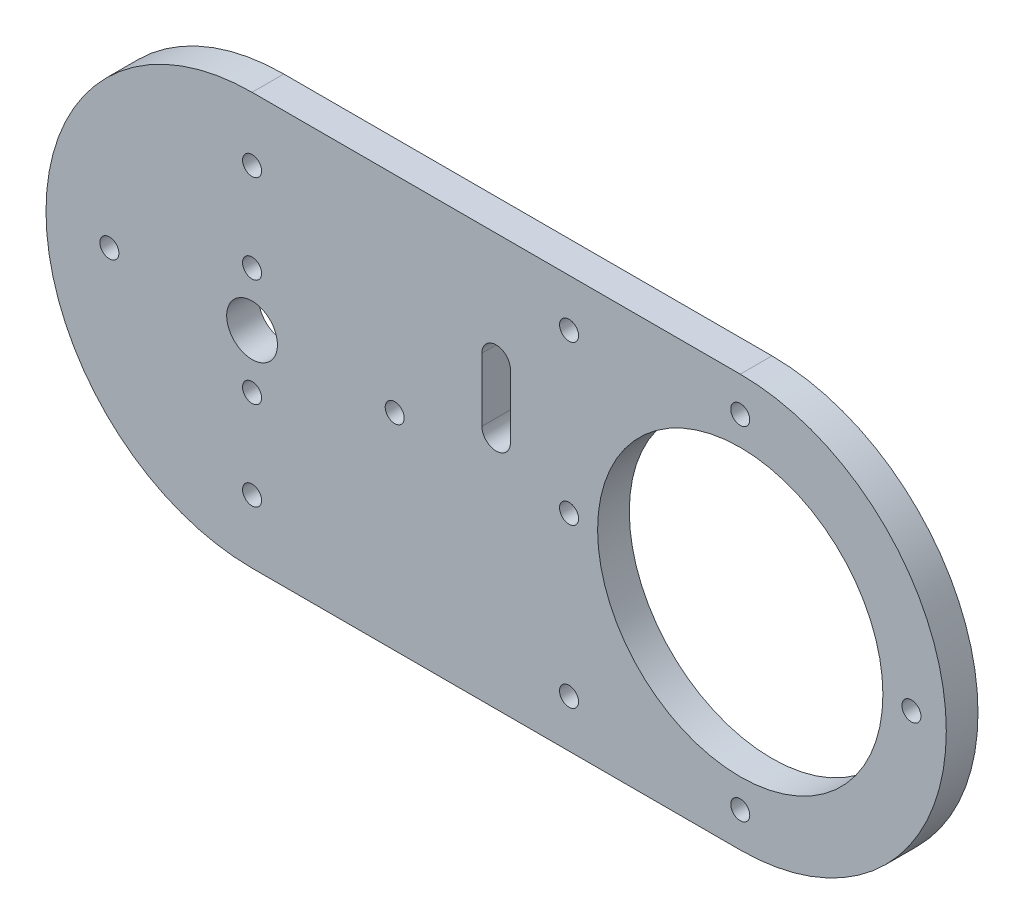
from build123d import *

# Parameters (mm, degrees)
SKETCH1_R           = 4
SKETCH1_R_2         = 22.5
SKETCH1_R_3         = 1.5
BOSS_EXTRUDE1_DEPTH = 5


with BuildPart() as part:
    # Sketch1 → Boss-Extrude1 (new body)
    with BuildSketch(Plane.XY):
        with BuildLine():
            Line((-38.5, 32.5), (38.5, 32.5))
            ThreePointArc((38.5, 32.5), (71, 0), (38.5, -32.5))
            Line((38.5, -32.5), (-38.5, -32.5))
            ThreePointArc((-38.5, -32.5), (-71, 0), (-38.5, 32.5))
        make_face()
        with Locations((-38.5, 0)):
            Circle(SKETCH1_R, mode=Mode.SUBTRACT)
        with Locations((38.5, 0)):
            Circle(SKETCH1_R_2, mode=Mode.SUBTRACT)
        with Locations((-38.5, 22.5)):
            Circle(SKETCH1_R_3, mode=Mode.SUBTRACT)
        with Locations((-16, 0)):
            Circle(SKETCH1_R_3, mode=Mode.SUBTRACT)
        with Locations((-38.5, -22.5)):
            Circle(SKETCH1_R_3, mode=Mode.SUBTRACT)
        with Locations((-61, 0)):
            Circle(SKETCH1_R_3, mode=Mode.SUBTRACT)
        with Locations((11.5, 0)):
            Circle(SKETCH1_R_3, mode=Mode.SUBTRACT)
        with Locations((11.5, -25)):
            Circle(SKETCH1_R_3, mode=Mode.SUBTRACT)
        with Locations((11.5, 25)):
            Circle(SKETCH1_R_3, mode=Mode.SUBTRACT)
        with Locations((65.5, 0)):
            Circle(SKETCH1_R_3, mode=Mode.SUBTRACT)
        with Locations((-38.5, 8.5)):
            Circle(SKETCH1_R_3, mode=Mode.SUBTRACT)
        with Locations((-38.5, -8.5)):
            Circle(SKETCH1_R_3, mode=Mode.SUBTRACT)
        with Locations((38.5, 27)):
            Circle(SKETCH1_R_3, mode=Mode.SUBTRACT)
        with Locations((38.5, -27)):
            Circle(SKETCH1_R_3, mode=Mode.SUBTRACT)
        with BuildLine():
            Line((-2.25, 5), (-2.25, 15))
            ThreePointArc((-2.25, 15), (0, 17.25), (2.25, 15))
            Line((2.25, 15), (2.25, 5))
            ThreePointArc((2.25, 5), (0, 2.75), (-2.25, 5))
        make_face(mode=Mode.SUBTRACT)
    extrude(amount=BOSS_EXTRUDE1_DEPTH)


solid = part.part
